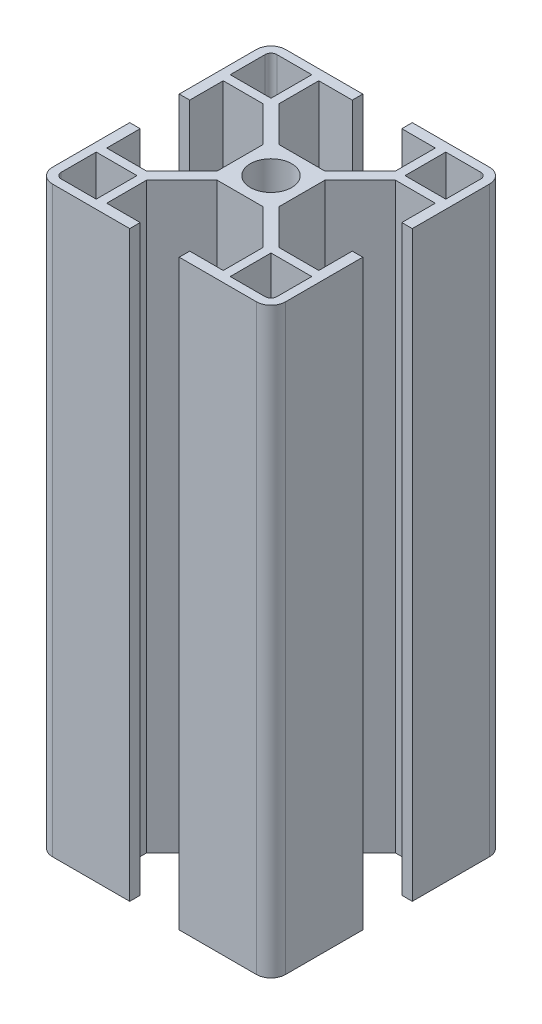
from build123d import *

# Parameters (mm, degrees)
SKETCH_1_R      = 3.55
SKETCH_1_W      = 7
SKETCH_1_H      = 7
EXTRUDE_1_DEPTH = 100
FILLET_1_R      = 1
FILLET_2_R      = 2.5


with BuildPart() as part:
    # 草图1 → 凸台-拉伸1 (new body)
    with BuildSketch(Plane(origin=(0, 0, 0), x_dir=(1, 0, 0), z_dir=(0, 1, 0))):
        Polygon((-20, 20), (-4.25, 20), (-4.25, 18.2), (-10, 18.2), (-10, 11.343502884), (-3.956497116, 5.3), (3.956497116, 5.3), (10, 11.343502884), (10, 18.2), (4.25, 18.2), (4.25, 20), (20, 20), (20, 4.25), (18.2, 4.25), (18.2, 10), (11.343502884, 10), (5.3, 3.956497116), (5.3, -3.956497116), (11.343502884, -10), (18.2, -10), (18.2, -4.25), (20, -4.25), (20, -20), (4.25, -20), (4.25, -18.2), (10, -18.2), (10, -11.343502884), (3.956497116, -5.3), (-3.956497116, -5.3), (-10, -11.343502884), (-10, -18.2), (-4.25, -18.2), (-4.25, -20), (-20, -20), (-20, -4.25), (-18.2, -4.25), (-18.2, -10), (-11.343502884, -10), (-5.3, -3.956497116), (-5.3, 3.956497116), (-11.343502884, 10), (-18.2, 10), (-18.2, 4.25), (-20, 4.25), align=None)
        with Locations(Location((0, 0, 0), (0, 0, 270))):
            Circle(SKETCH_1_R, mode=Mode.SUBTRACT)
        with Locations((-15, 15)):
            Rectangle(SKETCH_1_W, SKETCH_1_H, mode=Mode.SUBTRACT)
        with Locations((15, 15)):
            Rectangle(SKETCH_1_W, SKETCH_1_H, mode=Mode.SUBTRACT)
        with Locations((15, -15)):
            Rectangle(SKETCH_1_W, SKETCH_1_H, mode=Mode.SUBTRACT)
        with Locations((-15, -15)):
            Rectangle(SKETCH_1_W, SKETCH_1_H, mode=Mode.SUBTRACT)
    extrude(amount=EXTRUDE_1_DEPTH)

    # 圆角1
    fillet_1_edges = [part.edges().sort_by_distance(p)[0] for p in [
        (-18.5, 50, -18.5),
        (18.5, 50, -18.5),
        (18.5, 50, 18.5),
        (-18.5, 50, 18.5),
    ]]
    fillet(fillet_1_edges, radius=FILLET_1_R)

    # 圆角2
    fillet_2_edges = [part.edges().sort_by_distance(p)[0] for p in [
        (-20, 50, -20),
        (20, 50, -20),
        (20, 50, 20),
        (-20, 50, 20),
    ]]
    fillet(fillet_2_edges, radius=FILLET_2_R)


solid = part.part
